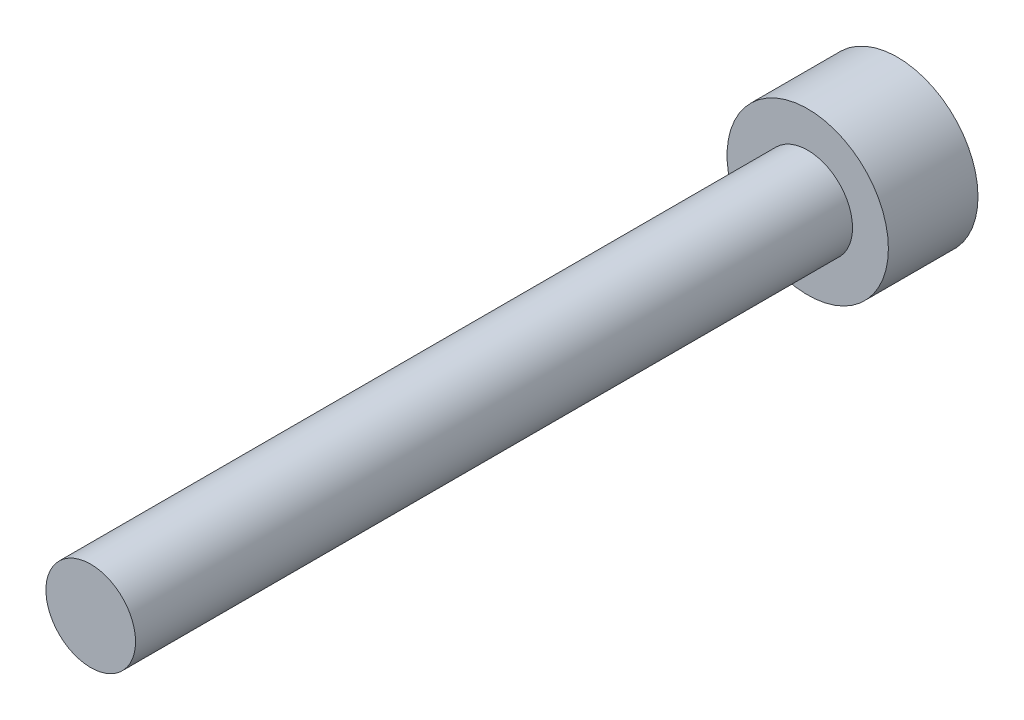
from build123d import *

# Parameters (mm, degrees)
CABEZA_START            = -2.5
SK_CABEZA_R             = 2.25
CABEZA_DEPTH            = 2.5
SK_CUERPO_R             = 1.25
CUERPO_DEPTH            = 20
HEXAGONO_INTERIOR_START = -2.5
HEXAGONO_INTERIOR_DEPTH = 1.25


with BuildPart() as part:
    # Sk_Cabeza → Cabeza (new body)
    with BuildSketch(Plane.XY.offset(CABEZA_START)):
        Circle(SK_CABEZA_R)
    extrude(amount=CABEZA_DEPTH)

    # Sk_Cuerpo → Cuerpo (add)
    with BuildSketch(Plane.XY):
        Circle(SK_CUERPO_R)
    extrude(amount=CUERPO_DEPTH)

    # Sk_Hexagono_interior → Hexagono_interior (cut)
    with BuildSketch(Plane.XY.offset(HEXAGONO_INTERIOR_START)):
        Polygon((0, -1.154700538), (1, -0.577350269), (1, 0.577350269), (0, 1.154700538), (-1, 0.577350269), (-1, -0.577350269), align=None)
    extrude(amount=HEXAGONO_INTERIOR_DEPTH, mode=Mode.SUBTRACT)


solid = part.part
